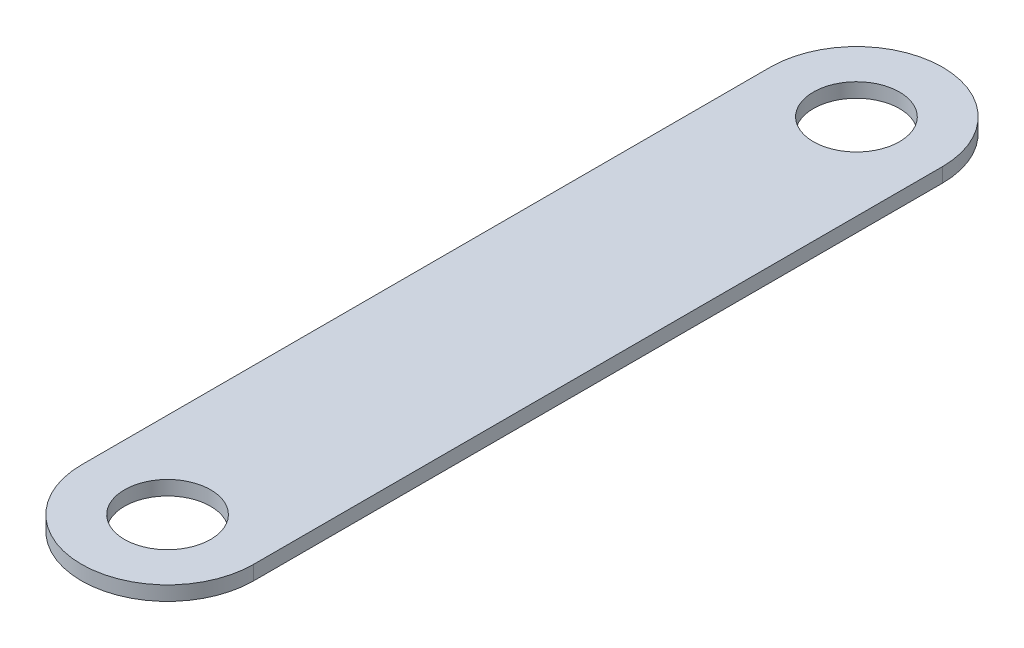
from build123d import *

# Parameters (mm, degrees)
SKETCH1_R           = 19.05
BOSS_EXTRUDE1_DEPTH = 6.35


with BuildPart() as part:
    # Sketch1 → Boss-Extrude1 (new body)
    with BuildSketch(Plane(origin=(0, 0, 0), x_dir=(1, 0, 0), z_dir=(0, 1, 0))):
        with BuildLine():
            Line((-38.1, 0), (-38.1, -304.8))
            ThreePointArc((-38.1, -304.8), (0, -342.9), (38.1, -304.8))
            Line((38.1, -304.8), (38.1, 0))
            ThreePointArc((38.1, 0), (0, 38.1), (-38.1, 0))
        make_face()
        with Locations(Location((0, 0, 0), (0, 0, 270))):
            Circle(SKETCH1_R, mode=Mode.SUBTRACT)
        with Locations(Location((0, -304.8, 0), (0, 0, 270))):
            Circle(SKETCH1_R, mode=Mode.SUBTRACT)
    extrude(amount=BOSS_EXTRUDE1_DEPTH)


solid = part.part
